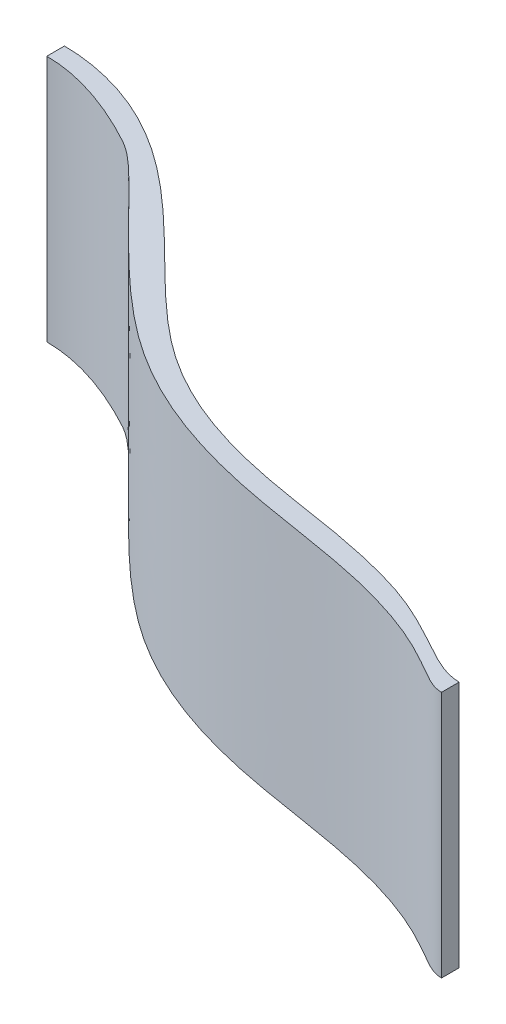
from build123d import *

# Parameters (mm, degrees)
EXTRUDE_1_DEPTH = 420


with BuildPart() as part:
    # 草图1 → 凸台-拉伸1 (new body)
    with BuildSketch(Plane(origin=(0, 0, 0), x_dir=(1, 0, 0), z_dir=(0, 1, 0))):
        with BuildLine():
            add(Edge.make_bspline(
                [(0, 30), (42.172481966, 30), (267.885357965, -19.43378782), (486.469740334, -345.712765109), (745.083096254, -425.526187691), (948.321873855, -455.022483049), (1150.377564707, -495.744478272), (1223.316403493, -570), (1270, -570)],
                knots=[0, 0, 0, 0, 0.084773907, 0.417203055, 0.651150272, 0.689340919, 0.799109527, 1, 1, 1, 1], degree=3))
            Line((1270, -570), (1270, -600))
            add(Edge.make_bspline(
                [(0, 0), (63.91631522, 0), (150.210740564, -38.870655704), (245.199863379, -90.974652103), (512.561266581, -420.540297934), (858.814807697, -476.037260949), (1192.614138347, -530.302900736), (1228.945314055, -600), (1270, -600)],
                knots=[0, 0, 0, 0, 0.117725014, 0.147165533, 0.294405182, 0.459333825, 0.529893307, 1, 1, 1, 1], degree=3))
            Line((0, 0), (0, 30))
        make_face()
    extrude(amount=EXTRUDE_1_DEPTH)


solid = part.part
